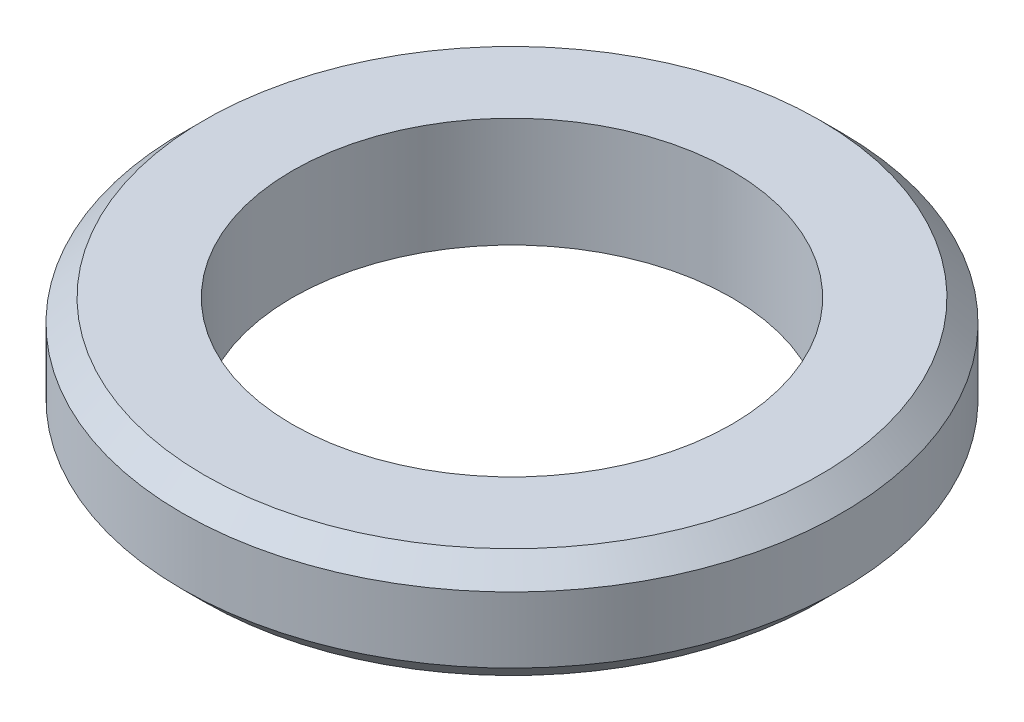
from build123d import *

# Parameters (mm, degrees)
SKETCH1_R            = 7.5
SKETCH1_R_2          = 5
CORPO_15_2_5_DEPTH   = 2.5
CHANFROS_0_5_45_SIZE = 0.5


with BuildPart() as part:
    # Sketch1 → Corpo Ø15×2.5 (new body)
    with BuildSketch(Plane(origin=(0, 0, 0), x_dir=(1, 0, 0), z_dir=(0, 1, 0))):
        with Locations(Location((0, 0, 0), (0, 0, 270))):
            Circle(SKETCH1_R)
        with Locations(Location((0, 0, 0), (0, 0, 270))):
            Circle(SKETCH1_R_2, mode=Mode.SUBTRACT)
    extrude(amount=CORPO_15_2_5_DEPTH)

    # Chanfros 0.5×45°
    chanfros_0_5_45_edges = [part.edges().sort_by_distance(p)[0] for p in [
        (0, 0, -7.5),
        (0, 2.5, -7.5),
    ]]
    chamfer(chanfros_0_5_45_edges, length=CHANFROS_0_5_45_SIZE)


solid = part.part
